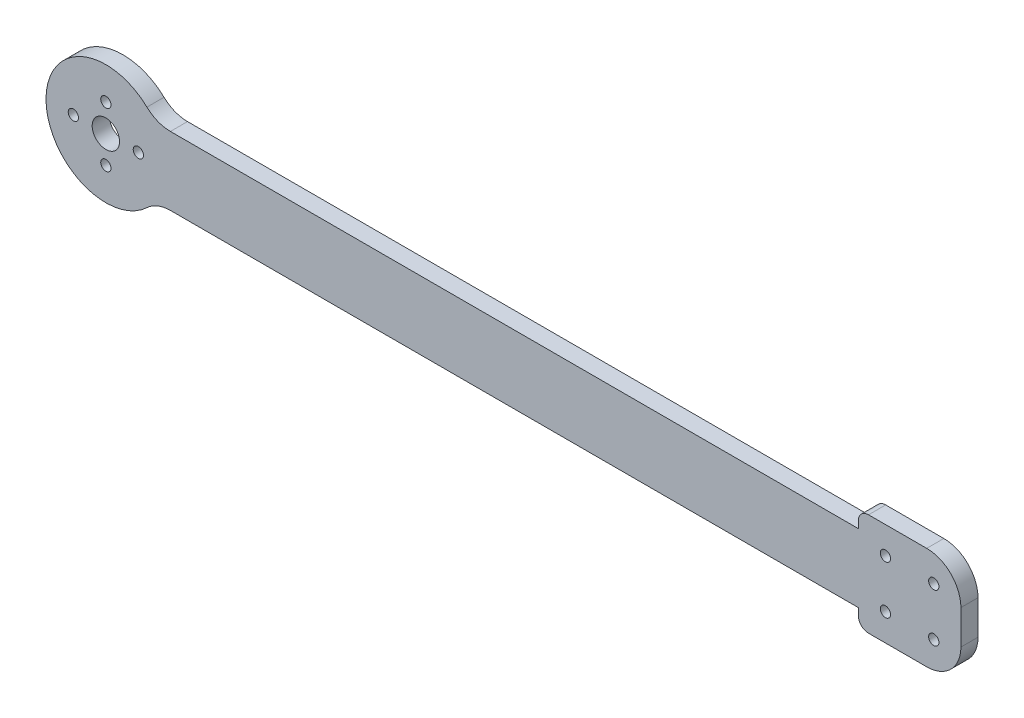
from build123d import *

# Parameters (mm, degrees)
SKETCH1_R           = 4
SKETCH1_R_2         = 1.5
BOSS_EXTRUDE2_DEPTH = 5


with BuildPart() as part:
    # Sketch1 → Boss-Extrude2 (new body)
    with BuildSketch(Plane.XY):
        with BuildLine():
            Line((220, -10), (220, -12))
            ThreePointArc((220, -12), (220.878679656, -14.121320344), (223, -15))
            Line((223, -15), (240, -15))
            ThreePointArc((240, -15), (247.071067812, -12.071067812), (250, -5))
            Line((250, -5), (250, 5))
            ThreePointArc((250, 5), (247.071067812, 12.071067812), (240, 15))
            Line((240, 15), (223, 15))
            ThreePointArc((223, 15), (220.878679656, 14.121320344), (220, 12))
            Line((220, 12), (220, 10))
            Line((220, 10), (18.874586088, 10))
            ThreePointArc((18.874586088, 10), (15.181841359, 10.706796227), (12.011100238, 12.727272727))
            ThreePointArc((12.011100238, 12.727272727), (-17.5, 0), (12.011100238, -12.727272727))
            ThreePointArc((12.011100238, -12.727272727), (15.181841359, -10.706796227), (18.874586088, -10))
            Line((18.874586088, -10), (220, -10))
        make_face()
        Circle(SKETCH1_R, mode=Mode.SUBTRACT)
        with Locations((9.5, 0)):
            Circle(SKETCH1_R_2, mode=Mode.SUBTRACT)
        with Locations((-9.5, 0)):
            Circle(SKETCH1_R_2, mode=Mode.SUBTRACT)
        with Locations((0, 8)):
            Circle(SKETCH1_R_2, mode=Mode.SUBTRACT)
        with Locations((0, -8)):
            Circle(SKETCH1_R_2, mode=Mode.SUBTRACT)
        with Locations((227.928932188, 7.071067812)):
            Circle(SKETCH1_R_2, mode=Mode.SUBTRACT)
        with Locations(Location((242.071067812, -7.071067812, 0), (0, 0, 180))):
            Circle(SKETCH1_R_2, mode=Mode.SUBTRACT)
        with Locations((242.071067812, 7.071067812)):
            Circle(SKETCH1_R_2, mode=Mode.SUBTRACT)
        with Locations(Location((227.928932188, -7.071067812, 0), (0, 0, 180))):
            Circle(SKETCH1_R_2, mode=Mode.SUBTRACT)
    extrude(amount=BOSS_EXTRUDE2_DEPTH)


solid = part.part
